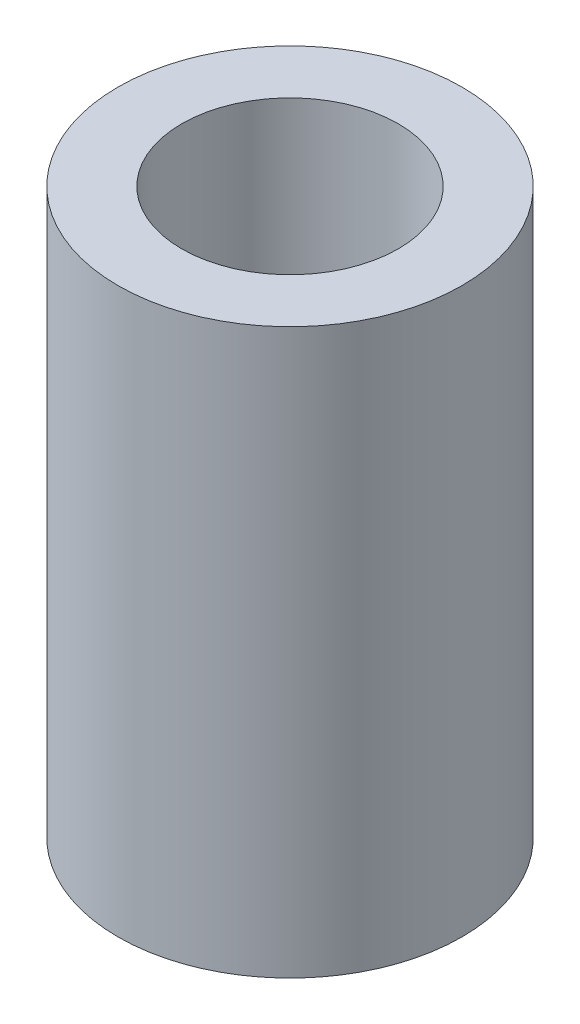
from build123d import *

# Parameters (mm, degrees)
SKETCH2_R           = 3.175
SKETCH2_R_2         = 2
BOSS_EXTRUDE1_DEPTH = 10.414


with BuildPart() as part:
    # Sketch2 → Boss-Extrude1 (new body)
    with BuildSketch(Plane(origin=(0, 0, 0), x_dir=(1, 0, 0), z_dir=(0, 1, 0))):
        with Locations(Location((0, 0, 0), (0, 0, 270))):
            Circle(SKETCH2_R)
        with Locations(Location((0, 0, 0), (0, 0, 270))):
            Circle(SKETCH2_R_2, mode=Mode.SUBTRACT)
    extrude(amount=-BOSS_EXTRUDE1_DEPTH)


solid = part.part
